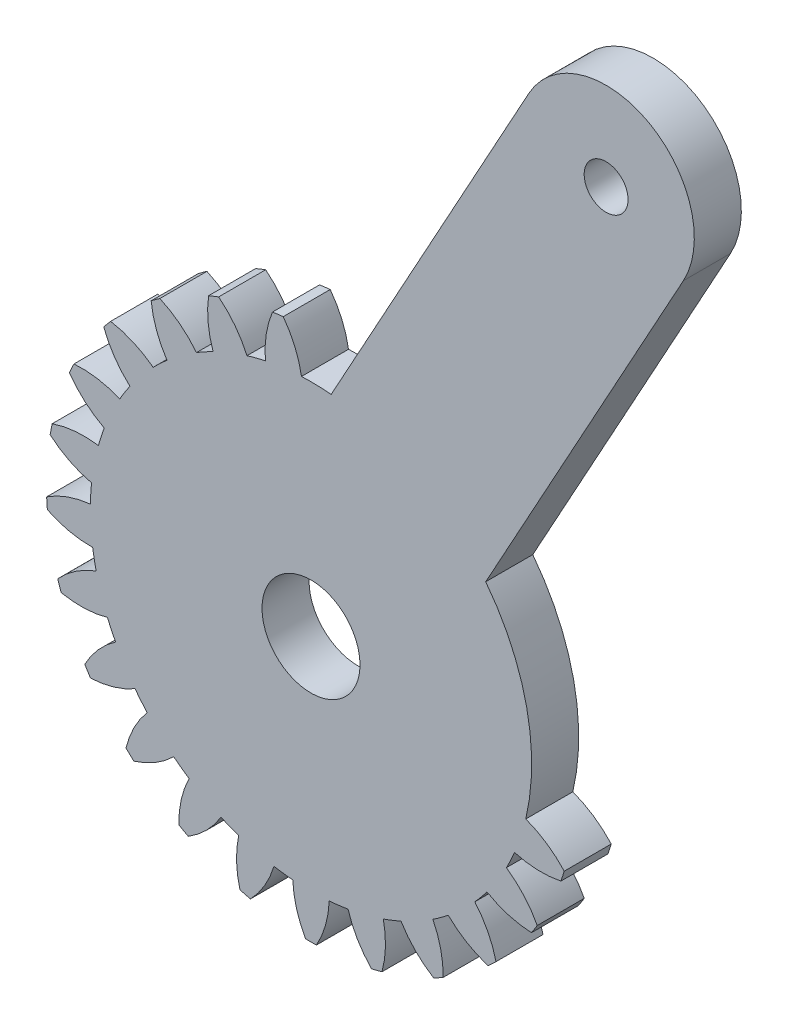
from build123d import *

# Parameters (mm, degrees)
MODEL_R             = 3.175
BOSS_EXTRUDE1_DEPTH = 3.048
BOSS_EXTRUDE2_START = -3.048
SKETCH2_R           = 5.715
SKETCH2_R_2         = 1.4224
BOSS_EXTRUDE2_DEPTH = 3.048


with BuildPart() as part:
    # Model → Boss-Extrude1 (new body)
    with BuildSketch(Plane.XY):
        with BuildLine():
            ThreePointArc((-0.616026415, 14.286925194), (-1.042592722, 15.739677645), (-1.800954663, 17.050149187))
            ThreePointArc((-1.800954663, 17.050149187), (-2.148838289, 17.009806554), (-2.495825317, 16.962366609))
            ThreePointArc((-2.495825317, 16.962366609), (-2.904460903, 15.504468994), (-2.956341002, 13.991274707))
            ThreePointArc((-2.956341002, 13.991274707), (-3.556315124, 13.850932921), (-4.149686627, 13.684875627))
            ThreePointArc((-4.149686627, 13.684875627), (-4.924136412, 14.985904462), (-5.984574038, 16.066608185))
            ThreePointArc((-5.984574038, 16.066608185), (-6.311495456, 15.941017851), (-6.635783413, 15.808776154))
            ThreePointArc((-6.635783413, 15.808776154), (-6.669016568, 14.295057536), (-6.342950641, 12.816500973))
            ThreePointArc((-6.342950641, 12.816500973), (-6.88917389, 12.531360786), (-7.422606766, 12.222954996))
            ThreePointArc((-7.422606766, 12.222954996), (-8.496278501, 13.290511787), (-9.792160616, 14.073543103))
            ThreePointArc((-9.792160616, 14.073543103), (-10.077578151, 13.870596369), (-10.358790833, 13.661862153))
            ThreePointArc((-10.358790833, 13.661862153), (-10.014533394, 12.187435039), (-9.331009364, 10.836419348))
            ThreePointArc((-9.331009364, 10.836419348), (-9.789160524, 10.424397166), (-10.229137224, 9.993021149))
            ThreePointArc((-10.229137224, 9.993021149), (-11.534568165, 10.760027378), (-12.98446973, 11.196185548))
            ThreePointArc((-12.98446973, 11.196185548), (-13.210449547, 10.928634304), (-13.430917328, 10.656523107))
            ThreePointArc((-13.430917328, 10.656523107), (-12.730800257, 9.314031176), (-11.732766451, 8.175445642))
            ThreePointArc((-11.732766451, 8.175445642), (-12.0740582, 7.662430334), (-12.39293337, 7.135189032))
            ThreePointArc((-12.39293337, 7.135189032), (-13.84809849, 7.553450876), (-15.360916858, 7.615330478))
            ThreePointArc((-15.360916858, 7.615330478), (-15.513259815, 7.299985954), (-15.659129891, 6.981595523))
            ThreePointArc((-15.659129891, 6.981595523), (-14.647144119, 5.85539248), (-13.397310672, 5.000778618))
            ThreePointArc((-13.397310672, 5.000778618), (-13.600298394, 4.419004823), (-13.778035935, 3.829026746))
            ThreePointArc((-13.778035935, 3.829026746), (-15.291501858, 3.872263276), (-16.772181085, 3.555976188))
            ThreePointArc((-16.772181085, 3.555976188), (-16.841314914, 3.212652639), (-16.903421733, 2.867988616))
            ThreePointArc((-16.903421733, 2.867988616), (-15.643154047, 2.02883794), (-14.220052592, 1.511894283))
            ThreePointArc((-14.220052592, 1.511894283), (-14.271981822, 0.897916987), (-14.297413829, 0.282272628))
            ThreePointArc((-14.297413829, 0.282272628), (-15.774083925, -0.052232867), (-17.129587491, -0.726813165))
            ThreePointArc((-17.129587491, -0.726813165), (-17.111168259, -1.076543457), (-17.085609422, -1.425824564))
            ThreePointArc((-17.085609422, -1.425824564), (-15.656247076, -1.92519595), (-14.14929631, -2.071987931))
            ThreePointArc((-14.14929631, -2.071987931), (-14.046904143, -2.679590275), (-13.918432631, -3.282217718))
            ThreePointArc((-13.918432631, -3.282217718), (-15.265522286, -3.973447027), (-16.410678917, -4.963934173))
            ThreePointArc((-16.410678917, -4.963934173), (-16.305863972, -5.298096369), (-16.194245434, -5.630047943))
            ThreePointArc((-16.194245434, -5.630047943), (-14.68560052, -5.758262697), (-13.189487703, -5.525679522))
            ThreePointArc((-13.189487703, -5.525679522), (-12.939207816, -6.088729025), (-12.664905121, -6.640474253))
            ThreePointArc((-12.664905121, -6.640474253), (-13.797771739, -7.644994897), (-14.660627033, -8.889152941))
            ThreePointArc((-14.660627033, -8.889152941), (-14.476002283, -9.1867504), (-14.285337446, -9.480514703))
            ThreePointArc((-14.285337446, -9.480514703), (-12.792203675, -9.229516622), (-11.400935076, -8.632172348))
            ThreePointArc((-11.400935076, -8.632172348), (-11.018493474, -9.115290538), (-10.615595045, -9.581485369))
            ThreePointArc((-10.615595045, -9.581485369), (-11.46305645, -10.836179621), (-11.989394033, -12.255833538))
            ThreePointArc((-11.989394033, -12.255833538), (-11.736560131, -12.498167117), (-11.47882917, -12.735285858))
            ThreePointArc((-11.47882917, -12.735285858), (-10.095025626, -12.120846074), (-8.896019768, -11.196274037))
            ThreePointArc((-8.896019768, -11.196274037), (-8.405446665, -11.569104823), (-7.899268091, -11.920456521))
            ThreePointArc((-7.899268091, -11.920456521), (-8.408075165, -13.346487327), (-8.564823313, -14.85243504))
            ThreePointArc((-8.564823313, -14.85243504), (-8.259666742, -15.024278029), (-7.95106384, -15.189852165))
            ThreePointArc((-7.95106384, -15.189852165), (-6.76353999, -14.25057819), (-5.832134822, -13.056872652))
            ThreePointArc((-5.832134822, -13.056872652), (-5.264254728, -13.295989703), (-4.686601071, -13.510421549))
            ThreePointArc((-4.686601071, -13.510421549), (-4.824783595, -15.018186149), (-4.602093245, -16.515803425))
            ThreePointArc((-4.602093245, -16.515803425), (-4.263788115, -16.606358298), (-3.923703928, -16.689984197))
            ThreePointArc((-3.923703928, -16.689984197), (-3.007076261, -15.484894068), (-2.401795395, -14.097059939))
            ThreePointArc((-2.401795395, -14.097059939), (-1.792290307, -14.187438652), (-1.17945767, -14.251477104))
            ThreePointArc((-1.17945767, -14.251477104), (-0.938333127, -15.746237102), (-0.350196733, -17.14142314))
            ThreePointArc((-0.350196733, -17.14142314), (0, -17.145), (0.350196733, -17.14142314))
            ThreePointArc((0.350196733, -17.14142314), (0.938333127, -15.746237102), (1.17945767, -14.251477104))
            ThreePointArc((1.17945767, -14.251477104), (1.792290307, -14.187438652), (2.401795395, -14.097059939))
            ThreePointArc((2.401795395, -14.097059939), (3.007076261, -15.484894068), (3.923703928, -16.689984197))
            ThreePointArc((3.923703928, -16.689984197), (4.263788115, -16.606358298), (4.602093245, -16.515803425))
            ThreePointArc((4.602093245, -16.515803425), (4.824783595, -15.018186149), (4.686601071, -13.510421549))
            ThreePointArc((4.686601071, -13.510421549), (5.264254728, -13.295989704), (5.832134822, -13.056872652))
            ThreePointArc((5.832134822, -13.056872652), (6.76353999, -14.25057819), (7.95106384, -15.189852165))
            ThreePointArc((7.95106384, -15.189852165), (8.259666742, -15.024278029), (8.564823313, -14.85243504))
            ThreePointArc((8.564823313, -14.85243504), (8.408075165, -13.346487327), (7.899268091, -11.920456521))
            ThreePointArc((7.899268091, -11.920456521), (8.405446665, -11.569104823), (8.896019768, -11.196274037))
            ThreePointArc((8.896019768, -11.196274037), (10.095025626, -12.120846074), (11.47882917, -12.735285858))
            ThreePointArc((11.47882917, -12.735285858), (11.736560131, -12.498167117), (11.989394033, -12.255833538))
            ThreePointArc((11.989394033, -12.255833538), (11.46305645, -10.836179621), (10.615595045, -9.581485369))
            ThreePointArc((10.615595045, -9.581485369), (11.018493474, -9.115290538), (11.400935076, -8.632172348))
            ThreePointArc((11.400935076, -8.632172348), (12.792203675, -9.229516622), (14.285337446, -9.480514703))
            ThreePointArc((14.285337446, -9.480514703), (14.476002283, -9.1867504), (14.660627033, -8.889152941))
            ThreePointArc((14.660627033, -8.889152941), (13.797771739, -7.644994897), (12.664905121, -6.640474253))
            ThreePointArc((12.664905121, -6.640474253), (12.939207816, -6.088729025), (13.189487703, -5.525679522))
            ThreePointArc((13.189487703, -5.525679522), (14.68560052, -5.758262697), (16.194245434, -5.630047943))
            ThreePointArc((16.194245434, -5.630047943), (16.305863972, -5.298096369), (16.410678917, -4.963934173))
            ThreePointArc((16.410678917, -4.963934173), (15.265522286, -3.973447027), (13.918432631, -3.282217718))
            ThreePointArc((13.918432631, -3.282217718), (11.018493474, 9.115290538), (-0.616026415, 14.286925194))
        make_face()
        with Locations(Location((0, 0, 0), (0, 0, 180))):
            Circle(MODEL_R, mode=Mode.SUBTRACT)
    extrude(amount=BOSS_EXTRUDE1_DEPTH)

    # Sketch2 → Boss-Extrude2 (add)
    # profile 1 of 2: a face of its own
    with BuildSketch(Plane.XY.offset(3.048).offset(BOSS_EXTRUDE2_START)):
        with BuildLine():
            Line((14.117624536, 37.542772707), (1.307007018, 14.240345947))
            ThreePointArc((1.307007018, 14.240345947), (6.88917389, 12.531360786), (11.323192371, 8.733901452))
            Line((11.323192371, 8.733901452), (24.133809889, 32.036328212))
            ThreePointArc((24.133809889, 32.036328212), (16.372494965, 29.781457783), (14.117624536, 37.542772707))
        make_face()
    # profile 2 of 2: a face of its own
    with BuildSketch(Plane.XY.offset(3.048).offset(BOSS_EXTRUDE2_START)):
        with Locations((19.125717213, 34.789550459)):
            Circle(SKETCH2_R)
        with Locations((19.125717213, 34.789550459)):
            Circle(SKETCH2_R_2, mode=Mode.SUBTRACT)
    extrude(amount=BOSS_EXTRUDE2_DEPTH)


solid = part.part
